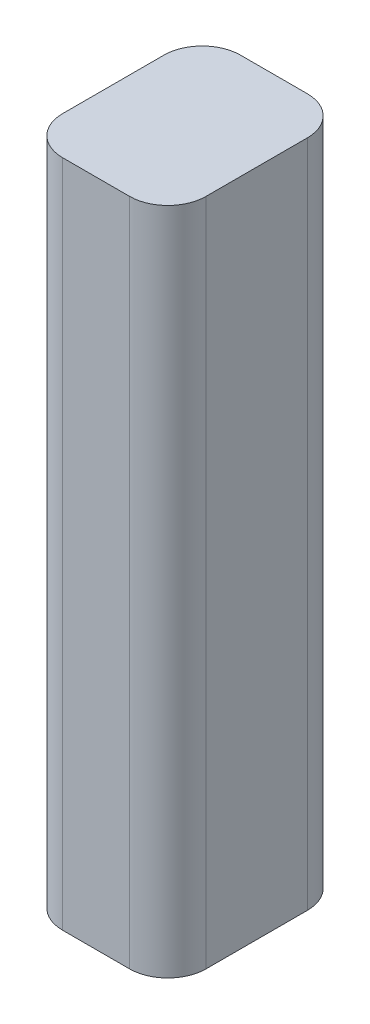
from build123d import *

# Parameters (mm, degrees)
BOSS_EXTRUDE1_DEPTH = 17.5


with BuildPart() as part:
    # Sketch1 → Boss-Extrude1 (new, symmetric)
    with BuildSketch(Plane(origin=(0, 0, 0), x_dir=(1, 0, 0), z_dir=(0, 1, 0))):
        with BuildLine():
            Line((-3.75, -2.65), (-3.75, 2.65))
            ThreePointArc((-3.75, 2.65), (-3.164213562, 4.064213562), (-1.75, 4.65))
            Line((-1.75, 4.65), (1.75, 4.65))
            ThreePointArc((1.75, 4.65), (3.164213562, 4.064213562), (3.75, 2.65))
            Line((3.75, 2.65), (3.75, -2.65))
            ThreePointArc((3.75, -2.65), (3.164213562, -4.064213562), (1.75, -4.65))
            Line((1.75, -4.65), (-1.75, -4.65))
            ThreePointArc((-1.75, -4.65), (-3.164213562, -4.064213562), (-3.75, -2.65))
        make_face()
    extrude(amount=BOSS_EXTRUDE1_DEPTH, both=True)


solid = part.part
